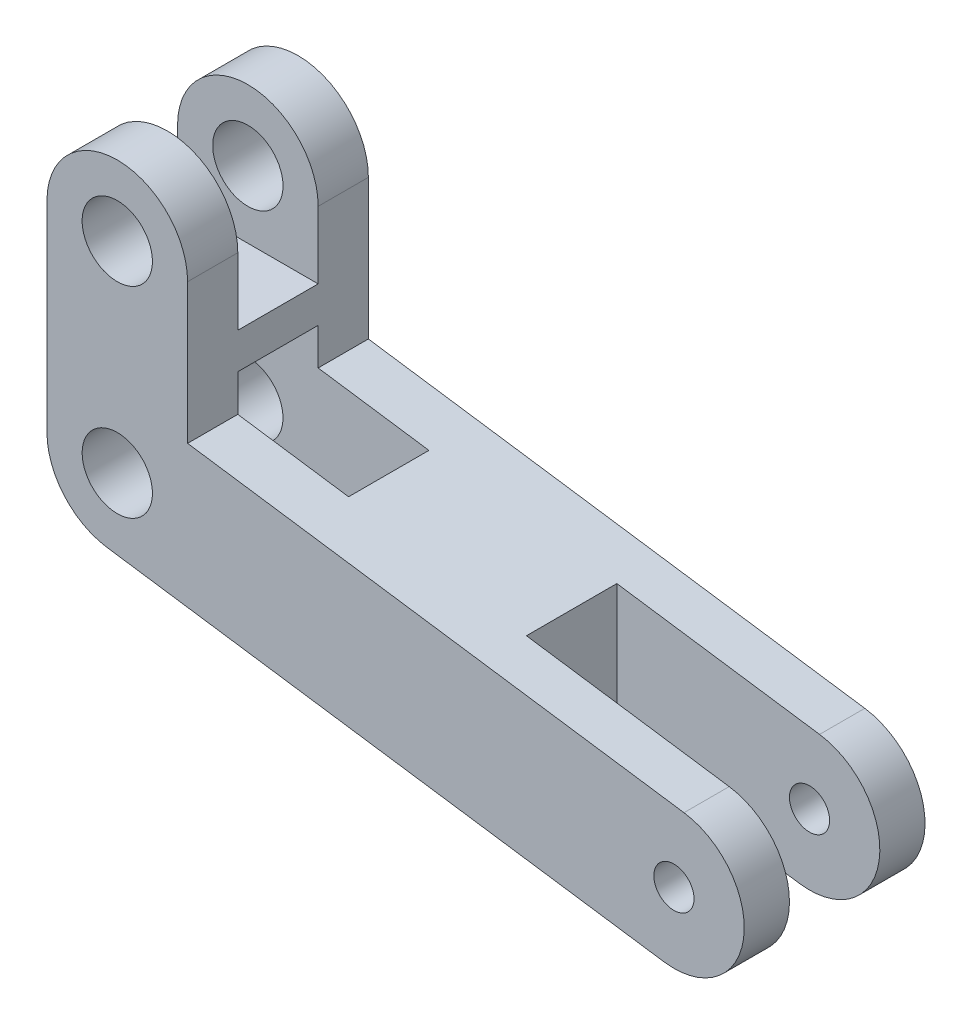
from build123d import *

# Parameters (mm, degrees)
SKETCH_1_R          = 1.75
SKETCH_1_R_2        = 1
EXTRUDE_1_DEPTH     = 4.5
SKETCH_5_W          = 9.199682462
SKETCH_5_H          = 9.813167506
SKETCH_5_W_2        = 14.660354758
SKETCH_5_H_2        = 10.525453646
CUT_EXTRUDE_3_DEPTH = 2
SKETCH_6_W          = 19.186818514
SKETCH_6_H          = 12
CUT_EXTRUDE_4_DEPTH = 2.25


with BuildPart() as part:
    # 草图1 → 凸台-拉伸1 (new, symmetric)
    with BuildSketch(Plane.XY):
        with BuildLine():
            Line((27.212812921, -7.464101615), (-0.5, -3.464101615))
            ThreePointArc((-0.5, -3.464101615), (-2.645751311, -2.291287847), (-3.5, 0))
            Line((-3.5, 0), (-3.5, 10))
            ThreePointArc((-3.5, 10), (0, 13.5), (3.5, 10))
            Line((3.5, 10), (3.5, 3.031088913))
            Line((3.5, 3.031088913), (28.212812921, -0.535898385))
            ThreePointArc((28.212812921, -0.535898385), (31.176914536, -4.5), (27.212812921, -7.464101615))
        make_face()
        Circle(SKETCH_1_R, mode=Mode.SUBTRACT)
        with Locations((0, 10)):
            Circle(SKETCH_1_R, mode=Mode.SUBTRACT)
        with Locations((27.712812921, -4)):
            Circle(SKETCH_1_R_2, mode=Mode.SUBTRACT)
    extrude(amount=EXTRUDE_1_DEPTH, both=True)

    # 草图5 → 切除-拉伸3 (cut, symmetric)
    with BuildSketch(Plane.XY):
        with Locations((-1.099841231, 11.563279791)):
            Rectangle(SKETCH_5_W, SKETCH_5_H)
        with Locations((1.684655549, -0.393377614)):
            Rectangle(SKETCH_5_W_2, SKETCH_5_H_2)
    extrude(amount=CUT_EXTRUDE_3_DEPTH, both=True, mode=Mode.SUBTRACT)

    # 草图6 → 切除-拉伸4 (cut, symmetric)
    with BuildSketch(Plane.XY):
        with Locations((27.712812921, -4)):
            Rectangle(SKETCH_6_W, SKETCH_6_H)
    extrude(amount=CUT_EXTRUDE_4_DEPTH, both=True, mode=Mode.SUBTRACT)


solid = part.part
